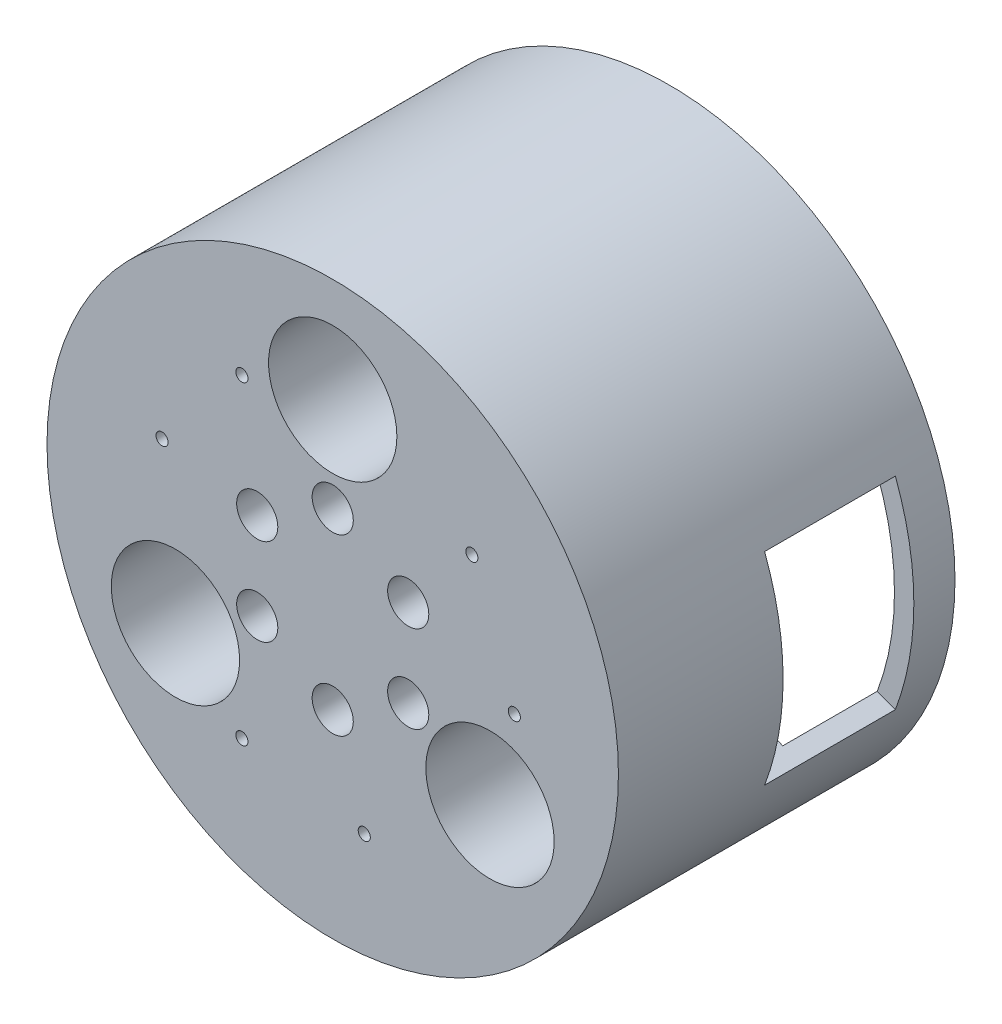
from build123d import *

# Parameters (mm, degrees)
SKETCH_1_R               = 59
F_01_BODY_D118_DEPTH     = 69.5
SKETCH_2_R               = 55
F_02_BORE_D110_DEPTH     = 28
SKETCH_3_R               = 54
F_03_BORE_D108_DEPTH     = 12
SKETCH_4_R               = 4.25
F_04_HOLES_6_D8_5_DEPTH  = 24
SKETCH_5_R               = 13.25
F_05_LOBES_3_D26_5_DEPTH = 19.5
SKETCH_6_R               = 9
F_06_THRU_3_D18_DEPTH    = 10
F_07_WINDOW_27X40_DEPTH  = 27
SKETCH_8_R               = 1.25
F_08_TAP_9_M3_DEPTH      = 6


with BuildPart() as part:
    # 草图1 → 01_BODY_D118 (new body)
    with BuildSketch(Plane.XY):
        Circle(SKETCH_1_R)
    extrude(amount=F_01_BODY_D118_DEPTH)

    # 草图2 → 02_BORE_D110 (cut)
    with BuildSketch(Plane.XY):
        Circle(SKETCH_2_R)
    extrude(amount=F_02_BORE_D110_DEPTH, mode=Mode.SUBTRACT)

    # 草图3 → 03_BORE_D108 (cut)
    with BuildSketch(Plane.XY.offset(28)):
        Circle(SKETCH_3_R)
    extrude(amount=F_03_BORE_D108_DEPTH, mode=Mode.SUBTRACT)

    # 草图4 → 04_HOLES_6_D8.5 (cut)
    with BuildSketch(Plane.XY.offset(69.5)):
        with Locations((15.588457268, 9)):
            Circle(SKETCH_4_R)
        with Locations((0, 18)):
            Circle(SKETCH_4_R)
        with Locations((-15.588457268, 9)):
            Circle(SKETCH_4_R)
        with Locations((-15.588457268, -9)):
            Circle(SKETCH_4_R)
        with Locations((0, -18)):
            Circle(SKETCH_4_R)
        with Locations((15.588457268, -9)):
            Circle(SKETCH_4_R)
    extrude(amount=-F_04_HOLES_6_D8_5_DEPTH, mode=Mode.SUBTRACT)

    # 草图5 → 05_LOBES_3_D26.5 (cut)
    with BuildSketch(Plane.XY.offset(69.5)):
        with Locations((0, 37.5)):
            Circle(SKETCH_5_R)
        with Locations((-32.475952642, -18.75)):
            Circle(SKETCH_5_R)
        with Locations((32.475952642, -18.75)):
            Circle(SKETCH_5_R)
    extrude(amount=-F_05_LOBES_3_D26_5_DEPTH, mode=Mode.SUBTRACT)

    # 草图6 → 06_THRU_3_D18 (cut)
    with BuildSketch(Plane.XY.offset(50)):
        with Locations((0, 37.5)):
            Circle(SKETCH_6_R)
        with Locations((-32.475952642, -18.75)):
            Circle(SKETCH_6_R)
        with Locations((32.475952642, -18.75)):
            Circle(SKETCH_6_R)
    extrude(amount=-F_06_THRU_3_D18_DEPTH, mode=Mode.SUBTRACT)

    # 草图7 → 07_WINDOW_27X40 (cut)
    with BuildSketch(Plane.XY.offset(8.5)):
        with BuildLine():
            Line((55.179875165, 20.884955752), (50.503614558, 19.115044248))
            ThreePointArc((50.503614558, 19.115044248), (54, 0), (50.503614558, -19.115044248))
            Line((50.503614558, -19.115044248), (55.179875165, -20.884955752))
            ThreePointArc((55.179875165, -20.884955752), (59, 0), (55.179875165, 20.884955752))
        make_face()
    extrude(amount=F_07_WINDOW_27X40_DEPTH, mode=Mode.SUBTRACT)

    # 草图8 → 08_TAP_9_M3 (cut)
    with BuildSketch(Plane.XY.offset(69.5)):
        with Locations((-18.75, 32.475952642)):
            Circle(SKETCH_8_R)
        with Locations((-35.238473279, 12.825755375)):
            Circle(SKETCH_8_R)
        with Locations((-35.238473279, -12.825755375)):
            Circle(SKETCH_8_R)
        with Locations((-18.75, -32.475952642)):
            Circle(SKETCH_8_R)
        with Locations((6.511806663, -36.930290738)):
            Circle(SKETCH_8_R)
        with Locations((28.726666617, -24.104535363)):
            Circle(SKETCH_8_R)
        with Locations((37.5, 0)):
            Circle(SKETCH_8_R)
        with Locations((28.726666617, 24.104535363)):
            Circle(SKETCH_8_R)
        with Locations((6.511806663, 36.930290738)):
            Circle(SKETCH_8_R)
    extrude(amount=-F_08_TAP_9_M3_DEPTH, mode=Mode.SUBTRACT)


solid = part.part
